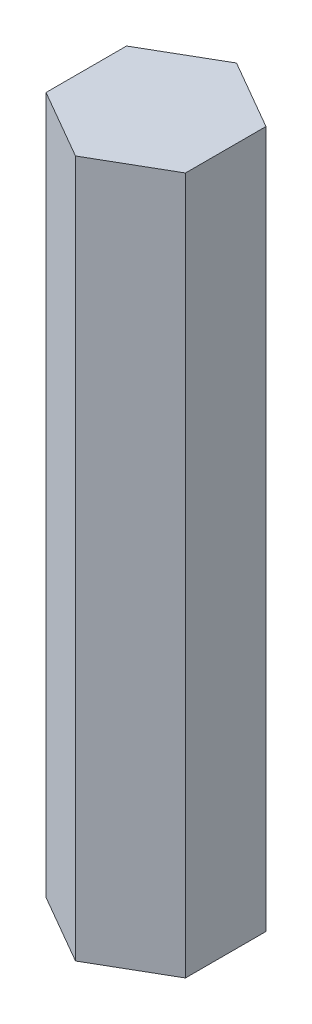
from build123d import *

# Parameters (mm, degrees)
BOSS_EXTRUDE1_DEPTH = 25


with BuildPart() as part:
    # Sketch1 → Boss-Extrude1 (new body)
    with BuildSketch(Plane(origin=(0, 0, 0), x_dir=(1, 0, 0), z_dir=(0, 1, 0))):
        Polygon((2.5, -1.443375673), (2.5, 1.443375673), (0, 2.886751346), (-2.5, 1.443375673), (-2.5, -1.443375673), (0, -2.886751346), align=None)
    extrude(amount=BOSS_EXTRUDE1_DEPTH)


solid = part.part
